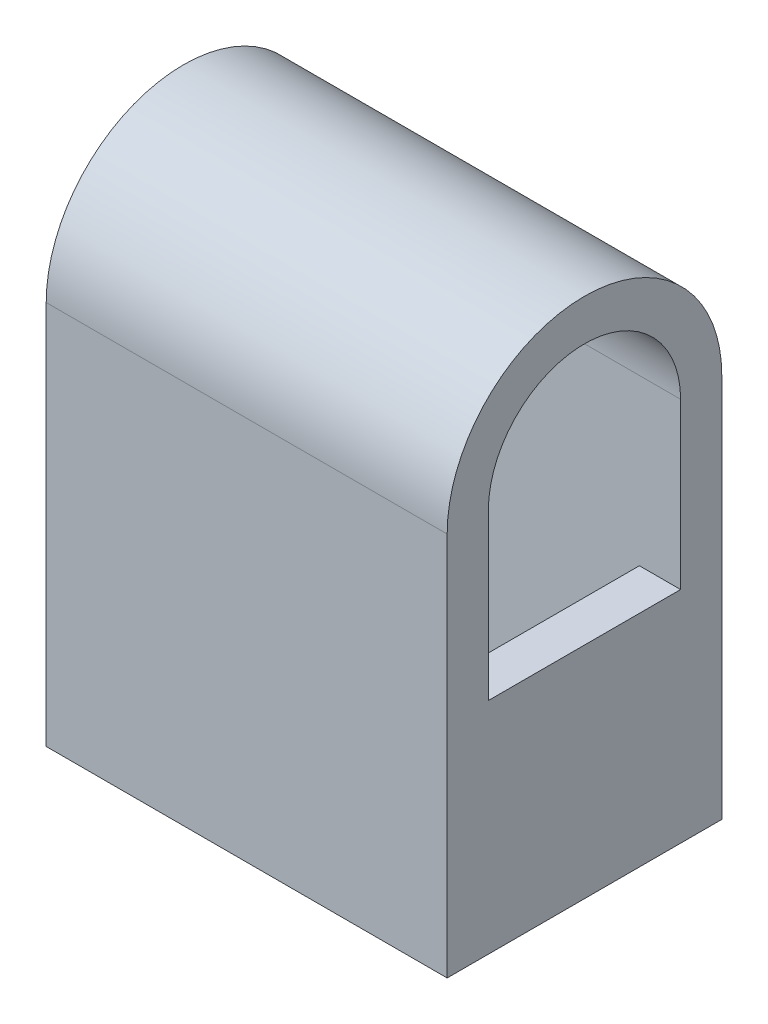
from build123d import *

# Parameters (mm, degrees)
SKETCH1_W            = 18.542
SKETCH1_H            = 17.78
BOSS_EXTRUDE4_DEPTH  = 1.905
SKETCH4_W            = 18.542
SKETCH4_H            = 17.78
BOSS_EXTRUDE5_DEPTH  = 1.905
BOSS_EXTRUDE6_DEPTH  = 18.542
SKETCH7_W            = 8.89
SKETCH7_H            = 10.16
BOSS_EXTRUDE7_DEPTH  = 1.905
SKETCH8_W            = 8.89
SKETCH8_H            = 10.16
BOSS_EXTRUDE8_DEPTH  = 1.905
SKETCH12_W           = 12.7
SKETCH12_H           = 12.7
BOSS_EXTRUDE11_DEPTH = 2.286
CUT_EXTRUDE2_DEPTH   = 22.721455683


with BuildPart() as part:
    # Sketch1 → Boss-Extrude4 (new body)
    with BuildSketch(Plane.XY):
        Rectangle(SKETCH1_W, SKETCH1_H)
    extrude(amount=-BOSS_EXTRUDE4_DEPTH)



with BuildPart() as body_2:
    # Sketch4 → Boss-Extrude5 (new body)
    with BuildSketch(Plane.XY.offset(-12.7)):
        Rectangle(SKETCH4_W, SKETCH4_H)
    extrude(amount=BOSS_EXTRUDE5_DEPTH)


with BuildPart() as part_1:
    add(part.part)

    add(body_2.part)  # Boss-Extrude6 merges body 2
    # Sketch6 → Boss-Extrude6 (add)
    with BuildSketch(Plane.ZY.offset(9.271)):
        with BuildLine():
            Line((-12.7, 8.89), (-10.795, 8.89))
            ThreePointArc((-10.795, 8.89), (-6.35, 13.335), (-1.905, 8.89))
            Line((-1.905, 8.89), (0, 8.89))
            ThreePointArc((0, 8.89), (-6.35, 15.24), (-12.7, 8.89))
        make_face()
    extrude(amount=-BOSS_EXTRUDE6_DEPTH)

    # Sketch7 → Boss-Extrude7 (add)
    with BuildSketch(Plane.ZY.offset(9.271)):
        with Locations((-6.35, -3.81)):
            Rectangle(SKETCH7_W, SKETCH7_H)
    extrude(amount=-BOSS_EXTRUDE7_DEPTH)

    # Sketch8 → Boss-Extrude8 (add)
    with BuildSketch(Plane(origin=(9.271, 0, 0), x_dir=(0, 0, -1), z_dir=(1, 0, 0))):
        with Locations((6.35, -3.81)):
            Rectangle(SKETCH8_W, SKETCH8_H)
    extrude(amount=-BOSS_EXTRUDE8_DEPTH)

    # Sketch12 → Boss-Extrude11 (add)
    with BuildSketch(Plane(origin=(0, 0, -12.7), x_dir=(-1, 0, 0), z_dir=(0, 0, -1))):
        with Locations((0, -2.54)):
            Rectangle(SKETCH12_W, SKETCH12_H)
    extrude(amount=BOSS_EXTRUDE11_DEPTH)

    # Sketch13 → Cut-Extrude2 (cut, through all)
    with BuildSketch(Plane(origin=(0, 3.81, 0), x_dir=(1, 0, 0), z_dir=(0, 1, 0))):
        Polygon((-5.08, 12.7), (5.08, 12.7), (5.08, 14.478), (-5.08, 14.420748278), align=None)
    extrude(amount=-CUT_EXTRUDE2_DEPTH, mode=Mode.SUBTRACT)


solid = part_1.part
